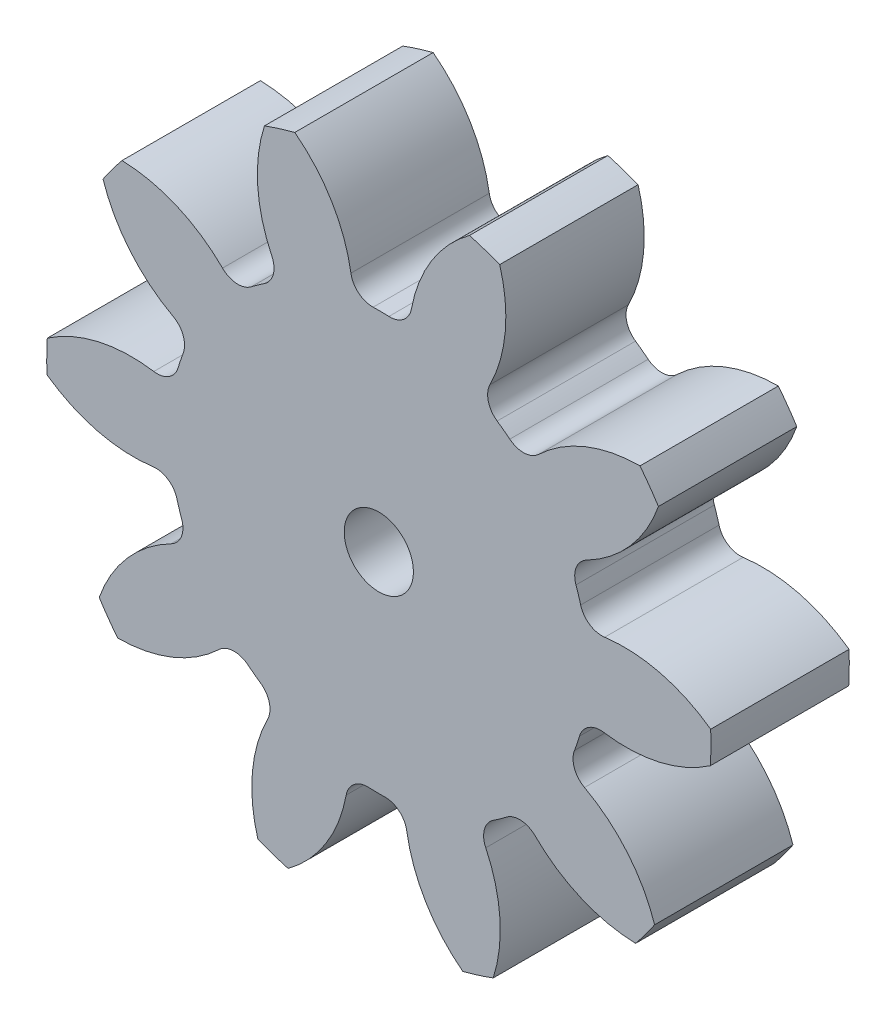
from build123d import *

# Parameters (mm, degrees)
SKETCH3_R         = 15.24
GEARBODY_DEPTH    = 6.35
TOOTHCUT_DEPTH    = 23.468593636
CIRPATTERN1_COUNT = 10
BOREDIA_R         = 1.5875
BORE_DEPTH        = 12700


with BuildPart() as part:
    # Sketch3 → gearBody (new body)
    with BuildSketch(Plane.XY):
        Circle(SKETCH3_R)
    extrude(amount=GEARBODY_DEPTH)

    # Sketch2 → toothCut (cut, through all)
    with BuildSketch(Plane.XY):
        with BuildLine():
            ThreePointArc((8.978148959, -3.402334891), (9.099733091, -3.062335565), (9.208446704, -2.718004919))
            ThreePointArc((9.208446704, -2.718004919), (9.633677899, -2.154183003), (10.324904213, -2.009535477))
            ThreePointArc((10.324904213, -2.009535477), (14.577189645, -1.27852495), (17.531773304, 1.865794244))
            ThreePointArc((17.531773304, 1.865794244), (16.709927513, -5.623396291), (12.836674632, -12.085695996))
            ThreePointArc((12.836674632, -12.085695996), (12.384259618, -7.794818645), (9.439116174, -4.64165549))
            ThreePointArc((9.439116174, -4.64165549), (8.975980875, -4.108530348), (8.978148959, -3.402334891))
        make_face()
    toothcut = extrude(amount=TOOTHCUT_DEPTH, mode=Mode.SUBTRACT)

    # CirPattern1: toothCut ×10 about axis
    cirpattern1_axis = Axis((0, 0, 6.35), (0, 0, -1))
    for i in range(1, CIRPATTERN1_COUNT):
        add(toothcut.rotate(cirpattern1_axis, i * 360 / CIRPATTERN1_COUNT), mode=Mode.SUBTRACT)

    # boreDia → bore (cut, symmetric)
    with BuildSketch(Plane.XY):
        Circle(BOREDIA_R)
    extrude(amount=BORE_DEPTH, both=True, mode=Mode.SUBTRACT)


solid = part.part
